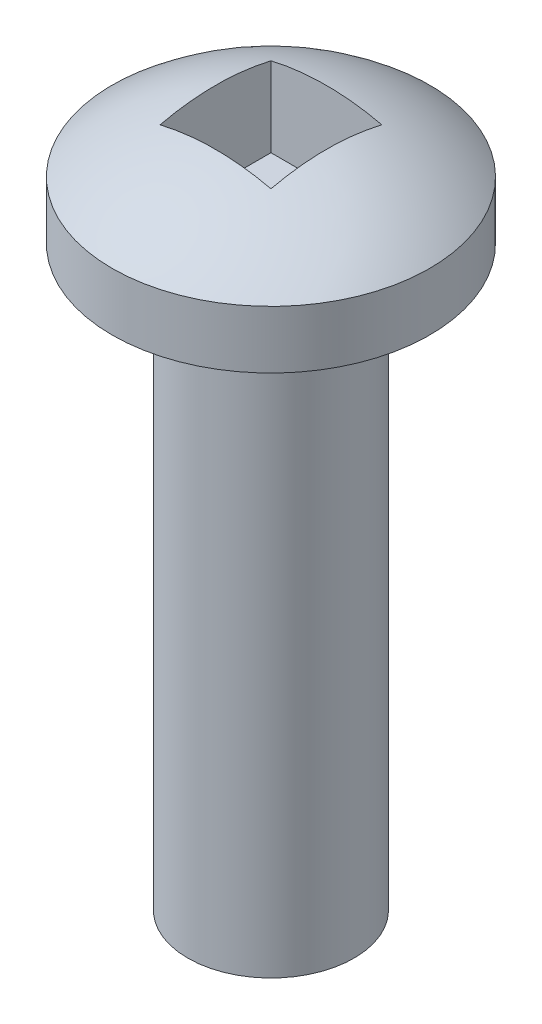
from build123d import *

# Parameters (mm, degrees)
SKETCH1_R           = 1.8288
BOSS_EXTRUDE1_DEPTH = 12.7
SKETCH2_R           = 3.4925
BOSS_EXTRUDE2_DEPTH = 1.27
DOME1_FACE_RADIUS   = 3.4925
DOME1_HEIGHT        = 1.27
SKETCH3_W           = 2.4384
SKETCH3_H           = 2.4384
CUT_EXTRUDE1_DEPTH  = 2.032


with BuildPart() as part:
    # Sketch1 → Boss-Extrude1 (new body)
    with BuildSketch(Plane(origin=(0, 0, 0), x_dir=(1, 0, 0), z_dir=(0, 1, 0))):
        with Locations(Location((0, 0, 0), (0, 0, 270))):
            Circle(SKETCH1_R)
    extrude(amount=-BOSS_EXTRUDE1_DEPTH)

    # Sketch2 → Boss-Extrude2 (add)
    with BuildSketch(Plane(origin=(0, 0, 0), x_dir=(1, 0, 0), z_dir=(0, 1, 0))):
        with Locations(Location((0, 0, 0), (0, 0, 270))):
            Circle(SKETCH2_R)
    extrude(amount=BOSS_EXTRUDE2_DEPTH)

    # Dome1: a dome of height H over a round flat face of radius A is a cap of a sphere of radius (A * A + H * H) / (2 * H)
    dome1_r = (DOME1_FACE_RADIUS * DOME1_FACE_RADIUS + DOME1_HEIGHT * DOME1_HEIGHT) / (2 * DOME1_HEIGHT)
    dome1_base = Plane((0, 1.27, 0), z_dir=(0, 1, 0))
    with Locations(dome1_base.offset(DOME1_HEIGHT - dome1_r)):
        dome1_ball = Sphere(dome1_r, mode=Mode.PRIVATE)
    add(split(dome1_ball, bisect_by=dome1_base, keep=Keep.TOP, mode=Mode.PRIVATE))

    # Sketch3 → Cut-Extrude1 (cut)
    with BuildSketch(Plane(origin=(0, 2.54, 0), x_dir=(1, 0, 0), z_dir=(0, 1, 0))):
        Rectangle(SKETCH3_W, SKETCH3_H)
    extrude(amount=-CUT_EXTRUDE1_DEPTH, mode=Mode.SUBTRACT)


solid = part.part
